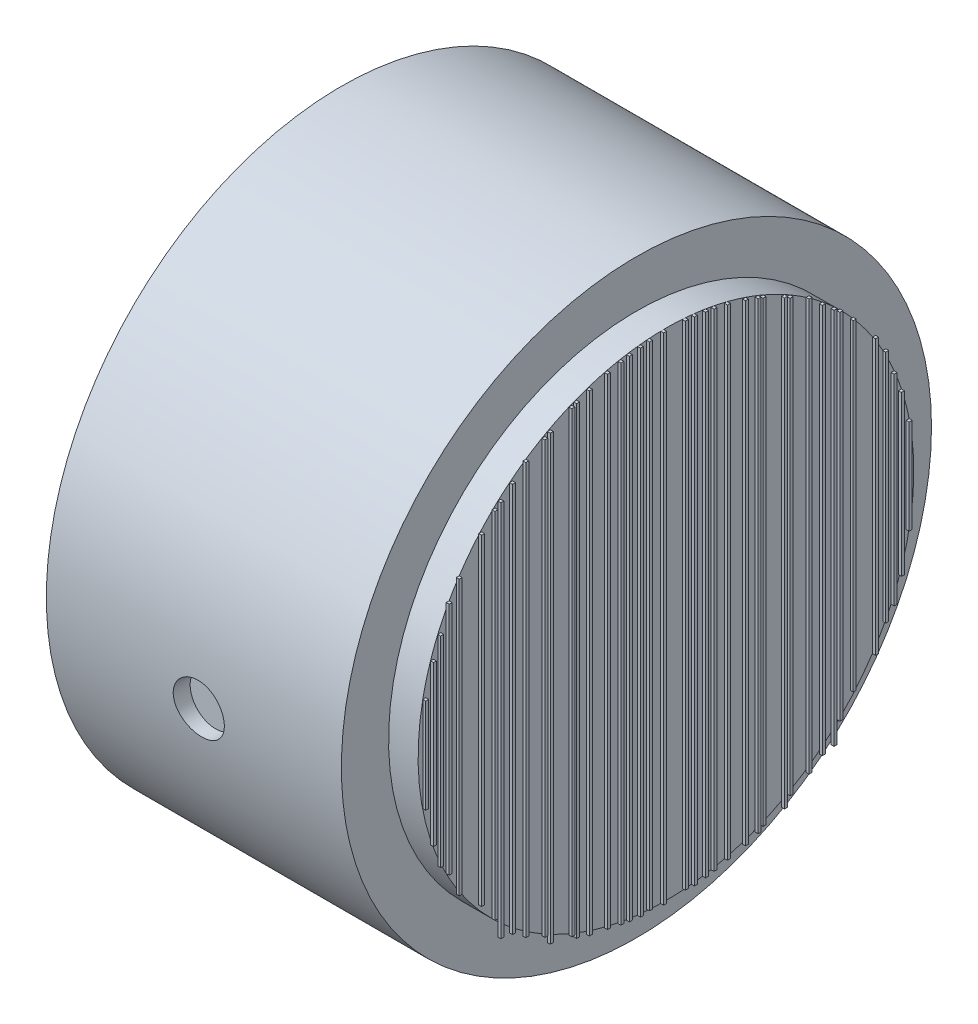
from build123d import *

# Parameters (mm, degrees)
SKETCH7_R            = 1000
LIGHT_CYLINDER_DEPTH = 500
SKETCH8_R            = 840
WINDOW_DEPTH         = 100
SKETCH9_W            = 10
SKETCH9_H            = 320.509206479
SKETCH9_H_2          = 540
SKETCH9_H_3          = 680
SKETCH9_H_4          = 1679.772408616
SKETCH9_H_5          = 929.362193436
SKETCH9_H_6          = 795.421096896
SKETCH9_H_7          = 1090
SKETCH9_H_8          = 1200
SKETCH9_H_9          = 1280
SKETCH9_H_10         = 1321.86803535
SKETCH9_H_11         = 1394.645990913
SKETCH9_H_12         = 1460
SKETCH9_H_13         = 1500
SKETCH9_H_14         = 1550
SKETCH9_H_15         = 1570
SKETCH9_H_16         = 1600
SKETCH9_H_17         = 1630
SKETCH9_H_18         = 1650
SKETCH9_H_19         = 1660
SKETCH9_H_20         = 1670
WINDOW_BARS_DEPTH    = 10
SKETCH10_R           = 87.5
CUT_EXTRUDE3_DEPTH   = 60
SKETCH16_R           = 86.453062677
CUT_EXTRUDE4_DEPTH   = 60


with BuildPart() as part:
    # Sketch7 → Light Cylinder (new, symmetric)
    with BuildSketch(Plane(origin=(0, 0, 0), x_dir=(0, 0, -1), z_dir=(1, 0, 0))):
        with Locations((0, 2580)):
            Circle(SKETCH7_R)
    extrude(amount=LIGHT_CYLINDER_DEPTH, both=True)

    # Sketch8 → Window (add)
    with BuildSketch(Plane(origin=(500, 0, 0), x_dir=(0, 0, -1), z_dir=(1, 0, 0))):
        with Locations((0, 2580)):
            Circle(SKETCH8_R)
    extrude(amount=WINDOW_DEPTH)

    # Sketch9 → Window Bars (add)
    with BuildSketch(Plane(origin=(600, 0, 0), x_dir=(0, 0, -1), z_dir=(1, 0, 0))):
        with Locations((-819.159668283, 2582.105617183)):
            Rectangle(SKETCH9_W, SKETCH9_H)
        with Locations((-793.026823856, 2572.208292025)):
            Rectangle(SKETCH9_W, SKETCH9_H_2)
        with Locations((-768.356667337, 2567.901608847)):
            Rectangle(SKETCH9_W, SKETCH9_H_3)
        with Locations((-12.890225908, 2579.923262069)):
            Rectangle(SKETCH9_W, SKETCH9_H_4)
        with Locations((-705.661475438, 2578.647616872)):
            Rectangle(SKETCH9_W, SKETCH9_H_5)
        with Locations((-739.807281863, 2589.300825497)):
            Rectangle(SKETCH9_W, SKETCH9_H_6)
        with Locations((-629.761703517, 2589.544877597)):
            Rectangle(SKETCH9_W, SKETCH9_H_7)
        with Locations((-584.494162996, 2581.588242267)):
            Rectangle(SKETCH9_W, SKETCH9_H_8)
        with Locations((-564.563571075, 2557.411806256)):
            Rectangle(SKETCH9_W, SKETCH9_H_9)
        with Locations((-525.048640961, 2570.716531481)):
            Rectangle(SKETCH9_W, SKETCH9_H_10)
        with Locations((-479.964579107, 2575.503569128)):
            Rectangle(SKETCH9_W, SKETCH9_H_11)
        with Locations((-415.532068146, 2577.153889944)):
            Rectangle(SKETCH9_W, SKETCH9_H_12)
        with Locations((-396.931579416, 2567.598132772)):
            Rectangle(SKETCH9_W, SKETCH9_H_13)
        with Locations((-323.953132128, 2577.909979793)):
            Rectangle(SKETCH9_W, SKETCH9_H_14)
        with Locations((-307.533275206, 2574.694139961)):
            Rectangle(SKETCH9_W, SKETCH9_H_15)
        with Locations((-264.618641636, 2575.553761906)):
            Rectangle(SKETCH9_W, SKETCH9_H_16)
        with Locations((-203.343167413, 2578.752495905)):
            Rectangle(SKETCH9_W, SKETCH9_H_17)
        with Locations((-157.952789138, 2579.042710369)):
            Rectangle(SKETCH9_W, SKETCH9_H_18)
        with Locations((-129.129372687, 2579.222112213)):
            Rectangle(SKETCH9_W, SKETCH9_H_19)
        with Locations((-91.376696206, 2579.452834154)):
            Rectangle(SKETCH9_W, SKETCH9_H_20)
        with Locations((-60.763863756, 2582.421706325)):
            Rectangle(SKETCH9_W, SKETCH9_H_20)
        with Locations((60.763863756, 2582.421706325)):
            Rectangle(SKETCH9_W, SKETCH9_H_20)
        with Locations((91.376696206, 2579.452834154)):
            Rectangle(SKETCH9_W, SKETCH9_H_20)
        with Locations((129.129372687, 2579.222112213)):
            Rectangle(SKETCH9_W, SKETCH9_H_19)
        with Locations((157.952789138, 2579.042710369)):
            Rectangle(SKETCH9_W, SKETCH9_H_18)
        with Locations((203.343167413, 2578.752495905)):
            Rectangle(SKETCH9_W, SKETCH9_H_17)
        with Locations((264.618641636, 2575.553761906)):
            Rectangle(SKETCH9_W, SKETCH9_H_16)
        with Locations((307.533275206, 2574.694139961)):
            Rectangle(SKETCH9_W, SKETCH9_H_15)
        with Locations((323.953132128, 2577.909979793)):
            Rectangle(SKETCH9_W, SKETCH9_H_14)
        with Locations((396.931579416, 2567.598132772)):
            Rectangle(SKETCH9_W, SKETCH9_H_13)
        with Locations((415.532068146, 2577.153889944)):
            Rectangle(SKETCH9_W, SKETCH9_H_12)
        with Locations((479.964579107, 2575.503569128)):
            Rectangle(SKETCH9_W, SKETCH9_H_11)
        with Locations((525.048640961, 2570.716531481)):
            Rectangle(SKETCH9_W, SKETCH9_H_10)
        with Locations((564.563571075, 2557.411806256)):
            Rectangle(SKETCH9_W, SKETCH9_H_9)
        with Locations((584.494162996, 2581.588242267)):
            Rectangle(SKETCH9_W, SKETCH9_H_8)
        with Locations((629.761703517, 2589.544877597)):
            Rectangle(SKETCH9_W, SKETCH9_H_7)
        with Locations((739.807281863, 2589.300825497)):
            Rectangle(SKETCH9_W, SKETCH9_H_6)
        with Locations((705.661475438, 2578.647616872)):
            Rectangle(SKETCH9_W, SKETCH9_H_5)
        with Locations((768.356667337, 2567.901608847)):
            Rectangle(SKETCH9_W, SKETCH9_H_3)
        with Locations((793.026823856, 2572.208292025)):
            Rectangle(SKETCH9_W, SKETCH9_H_2)
        with Locations((819.159668283, 2582.105617183)):
            Rectangle(SKETCH9_W, SKETCH9_H)
    extrude(amount=WINDOW_BARS_DEPTH)

    # Sketch10 → Cut-Extrude3 (cut)
    with BuildSketch(Plane(origin=(0, 0, -1000), x_dir=(-1, 0, 0), z_dir=(0, 0, -1))):
        with Locations((-13.915362499, 2507.187474352)):
            Circle(SKETCH10_R)
    extrude(amount=-CUT_EXTRUDE3_DEPTH, mode=Mode.SUBTRACT)

    # Sketch16 → Cut-Extrude4 (cut)
    with BuildSketch(Plane.XY.offset(1000)):
        with Locations((13.915362499, 2507.187474352)):
            Circle(SKETCH16_R)
    extrude(amount=-CUT_EXTRUDE4_DEPTH, mode=Mode.SUBTRACT)


solid = part.part
